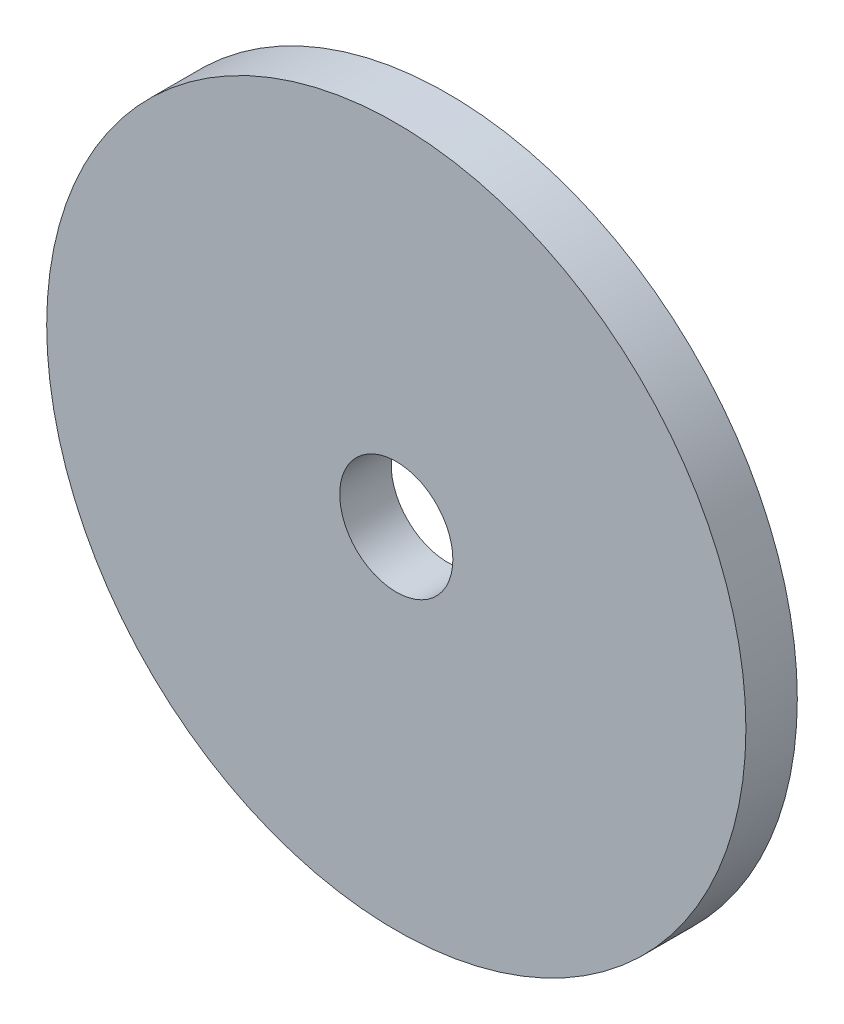
from build123d import *

# Parameters (mm, degrees)
SKETCH_1_R      = 34
SKETCH_1_R_2    = 5.5
EXTRUDE_1_DEPTH = 5


with BuildPart() as part:
    # Эскиз1 → Бобышка-Вытянуть1 (new body)
    with BuildSketch(Plane.XY):
        Circle(SKETCH_1_R)
        Circle(SKETCH_1_R_2, mode=Mode.SUBTRACT)
    extrude(amount=EXTRUDE_1_DEPTH)


solid = part.part
